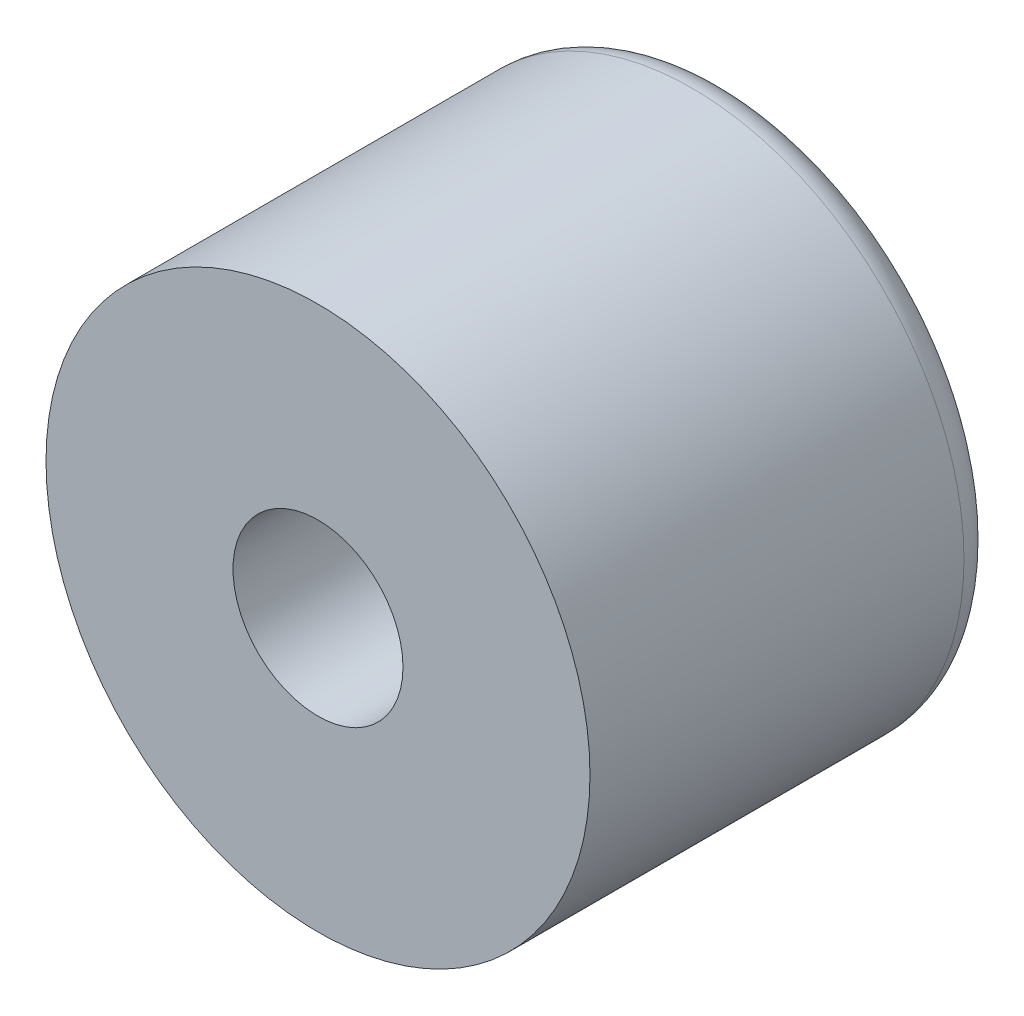
from build123d import *

# Parameters (mm, degrees)
SKETCH1_R           = 8
BOSS_EXTRUDE1_DEPTH = 12
SKETCH2_R           = 2.5
CUT_EXTRUDE1_DEPTH  = 5
FILLET1_R           = 1


with BuildPart() as part:
    # Sketch1 → Boss-Extrude1 (new body)
    with BuildSketch(Plane.XY):
        Circle(SKETCH1_R)
    extrude(amount=BOSS_EXTRUDE1_DEPTH)

    # Sketch2 → Cut-Extrude1 (cut)
    with BuildSketch(Plane.XY.offset(12)):
        Circle(SKETCH2_R)
    extrude(amount=-CUT_EXTRUDE1_DEPTH, mode=Mode.SUBTRACT)

    # Fillet1
    fillet1_edges = [part.edges().sort_by_distance(p)[0] for p in [
        (-8, 0, 0),
    ]]
    fillet(fillet1_edges, radius=FILLET1_R)


solid = part.part
